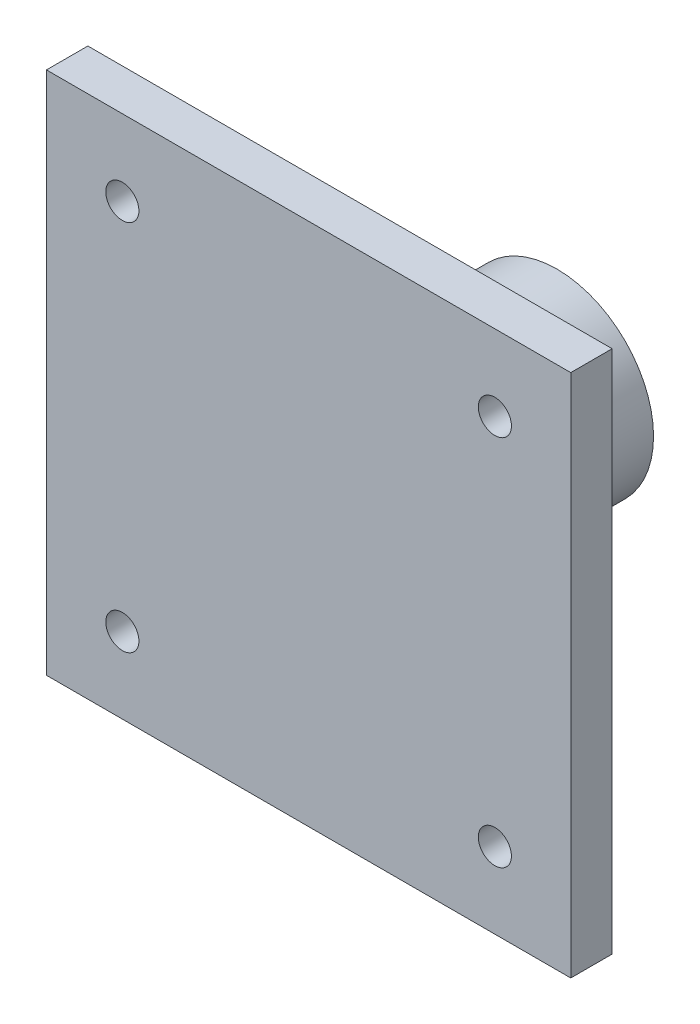
from build123d import *

# Parameters (mm, degrees)
SKETCH_1_W      = 38
SKETCH_1_H      = 38
SKETCH_1_R      = 1.2
EXTRUDE_1_DEPTH = 3
SKETCH_2_R      = 7
EXTRUDE_2_DEPTH = 15


with BuildPart() as part:
    # 草图1 → 凸台-拉伸1 (new body)
    with BuildSketch(Plane.XY):
        Rectangle(SKETCH_1_W, SKETCH_1_H)
        with Locations((-13.5, 13.5)):
            Circle(SKETCH_1_R, mode=Mode.SUBTRACT)
        with Locations((13.5, 13.5)):
            Circle(SKETCH_1_R, mode=Mode.SUBTRACT)
        with Locations((13.5, -13.5)):
            Circle(SKETCH_1_R, mode=Mode.SUBTRACT)
        with Locations((-13.5, -13.5)):
            Circle(SKETCH_1_R, mode=Mode.SUBTRACT)
    extrude(amount=EXTRUDE_1_DEPTH)

    # 草图2 → 凸台-拉伸2 (add)
    with BuildSketch(Plane(origin=(0, 0, 0), x_dir=(-1, 0, 0), z_dir=(0, 0, -1))):
        Circle(SKETCH_2_R)
    extrude(amount=EXTRUDE_2_DEPTH)


solid = part.part
